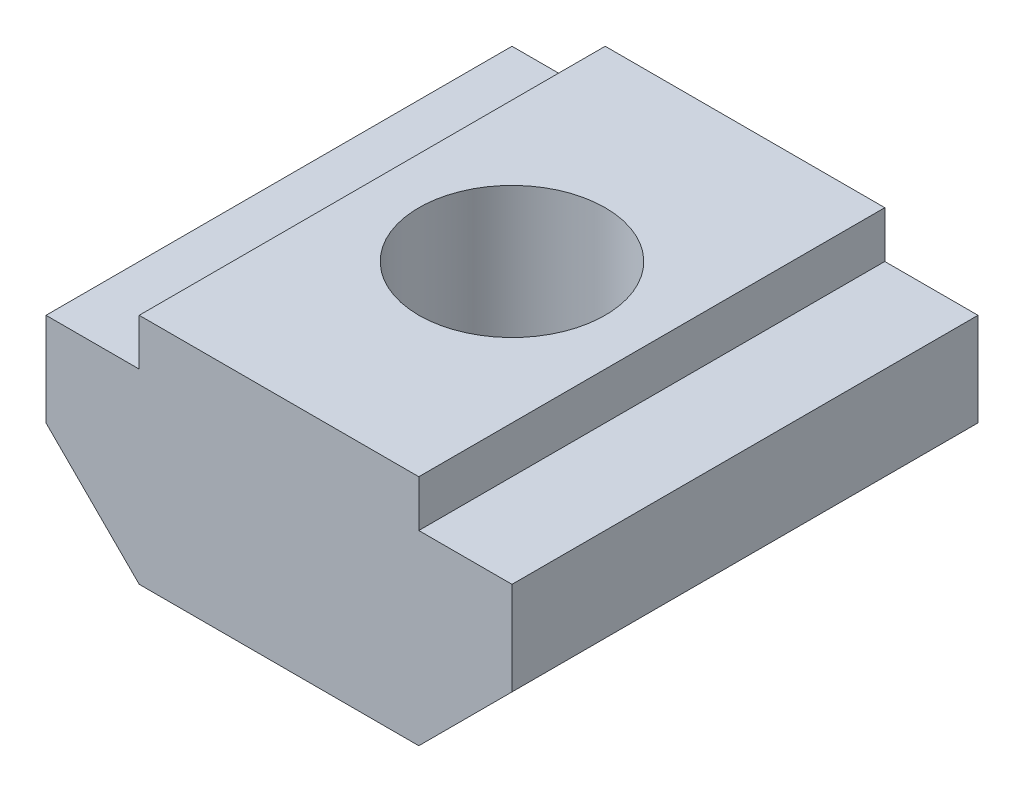
from build123d import *

# Parameters (mm, degrees)
RESSALTO_EXTRUS_O1_DEPTH = 10
CHANFRO1_SIZE            = 2
ESBO_O2_R                = 2
CORTE_EXTRUS_O1_DEPTH    = 5


with BuildPart() as part:
    # Esboço1 → Ressalto-extrusão1 (new body)
    with BuildSketch(Plane.XY):
        Polygon((-3, 0), (3, 0), (3, -1), (5, -1), (5, -5), (-5, -5), (-5, -1), (-3, -1), align=None)
    extrude(amount=RESSALTO_EXTRUS_O1_DEPTH)

    # Chanfro1
    chanfro1_edges = [part.edges().sort_by_distance(p)[0] for p in [
        (5, -5, 5),
        (-5, -5, 5),
    ]]
    chamfer(chanfro1_edges, length=CHANFRO1_SIZE)

    # Esboço2 → Corte-extrusão1 (cut)
    with BuildSketch(Plane(origin=(0, 0, 0), x_dir=(1, 0, 0), z_dir=(0, 1, 0))):
        with Locations(Location((0, -5, 0), (0, 0, 270))):
            Circle(ESBO_O2_R)
    extrude(amount=-CORTE_EXTRUS_O1_DEPTH, mode=Mode.SUBTRACT)


solid = part.part
